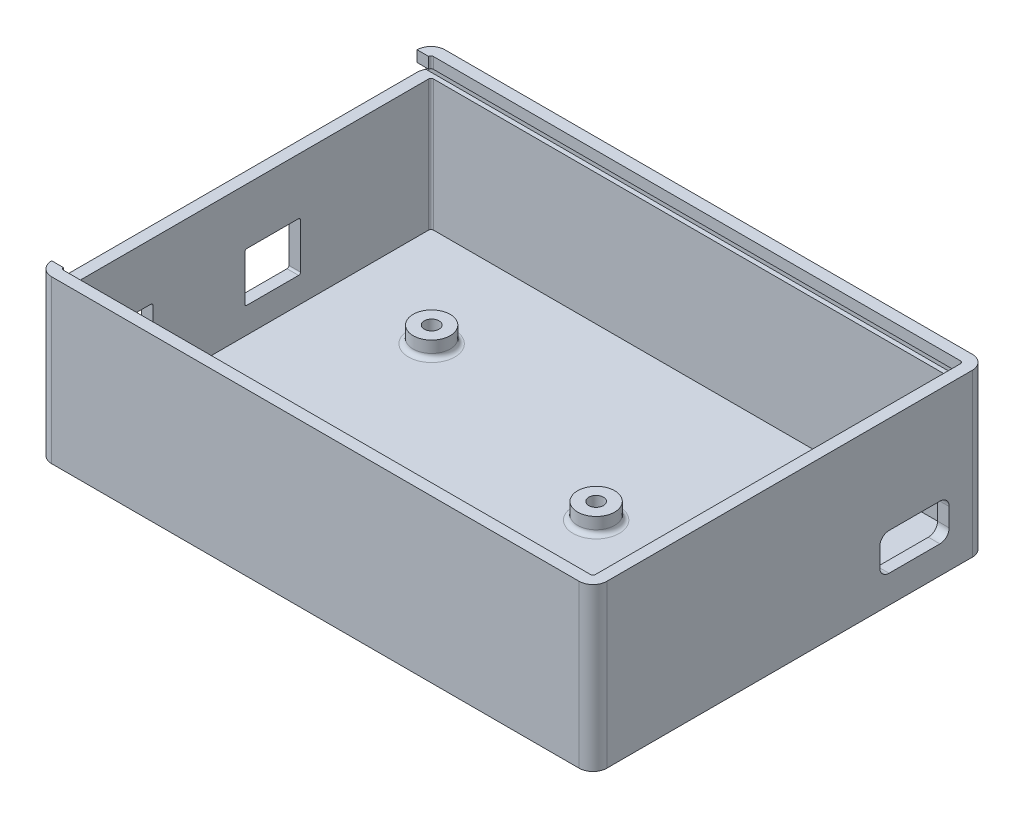
from build123d import *

# Parameters (mm, degrees)
SKETCH1_W                    = 120
SKETCH1_H                    = 85
BASE_EXTRUSION_DEPTH         = 35
EXTERNAL_CORNER_FILLETS_R    = 3
ENCLOSURE_SHELL_T            = -2.5
SKETCH2_R                    = 4
SKETCH2_R_2                  = 1.5875
ARDUINO_MOUNTING_HOLES_DEPTH = 6
STANDOFF_FILLETS_R           = 1
PORT_ACCESS_HOLE_DEPTH       = 6
SKETCH5_W                    = 15
SKETCH5_H                    = 8
WIRE_ACCESS_HOLE_DEPTH       = 6
WIRE_ACCESS_HOLE_FILLET_R    = 2
SKETCH6_R                    = 2.5
CABLE_ROUTING_POSTS_DEPTH    = 6
LID_CUT_EXTRUDE_DEPTH        = 117.5


with BuildPart() as part:
    # Sketch1 → base extrusion (new body)
    with BuildSketch(Plane(origin=(0, 0, 0), x_dir=(1, 0, 0), z_dir=(0, 1, 0))):
        Rectangle(SKETCH1_W, SKETCH1_H)
    extrude(amount=BASE_EXTRUSION_DEPTH)

    # external corner fillets
    external_corner_fillets_edges = [part.edges().sort_by_distance(p)[0] for p in [
        (60, 17.5, 42.5),
        (60, 17.5, -42.5),
        (-60, 17.5, -42.5),
        (-60, 17.5, 42.5),
    ]]
    fillet(external_corner_fillets_edges, radius=EXTERNAL_CORNER_FILLETS_R)

    # enclosure shell
    enclosure_shell_openings = [part.faces().sort_by_distance(p)[0] for p in [
        (0, 35, 0),
    ]]
    offset(amount=ENCLOSURE_SHELL_T, openings=enclosure_shell_openings, kind=Kind.INTERSECTION)

    # Sketch2 → arduino mounting holes (add)
    # profile 1 of 4: a face of its own
    with BuildSketch(Plane.XZ):
        with Locations(Location((-37.18, 29.719377118, 0), (0, 0, 270))):
            Circle(SKETCH2_R)
        with Locations(Location((-37.18, 29.719377118, 0), (0, 0, 270))):
            Circle(SKETCH2_R_2, mode=Mode.SUBTRACT)
    # profile 2 of 4: a face of its own
    with BuildSketch(Plane.XZ):
        with Locations(Location((14.89, 24.639377118, 0), (0, 0, 270))):
            Circle(SKETCH2_R)
        with Locations(Location((14.89, 24.639377118, 0), (0, 0, 270))):
            Circle(SKETCH2_R_2, mode=Mode.SUBTRACT)
    # profile 3 of 4: a face of its own
    with BuildSketch(Plane.XZ):
        with Locations(Location((14.89, -3.300622882, 0), (0, 0, 270))):
            Circle(SKETCH2_R)
        with Locations(Location((14.89, -3.300622882, 0), (0, 0, 270))):
            Circle(SKETCH2_R_2, mode=Mode.SUBTRACT)
    # profile 4 of 4: a face of its own
    with BuildSketch(Plane.XZ):
        with Locations(Location((-35.91, -18.540622882, 0), (0, 0, 270))):
            Circle(SKETCH2_R)
        with Locations(Location((-35.91, -18.540622882, 0), (0, 0, 270))):
            Circle(SKETCH2_R_2, mode=Mode.SUBTRACT)
    extrude(amount=-ARDUINO_MOUNTING_HOLES_DEPTH)

    # standoff fillets
    standoff_fillets_edges = [part.edges().sort_by_distance(p)[0] for p in [
        (-35.91, 2.5, -14.540622882),
        (14.89, 2.5, 0.699377118),
        (14.89, 2.5, 28.639377118),
        (-37.18, 2.5, 33.719377118),
    ]]
    fillet(standoff_fillets_edges, radius=STANDOFF_FILLETS_R)

    # Sketch4 → port access hole (cut)
    with BuildSketch(Plane.ZY.offset(60)):
        with BuildLine():
            Line((20.584377118, 18.65), (28.584377118, 18.65))
            ThreePointArc((28.584377118, 18.65), (28.937930508, 18.503553391), (29.084377118, 18.15))
            Line((29.084377118, 18.15), (29.084377118, 7.65))
            Line((29.084377118, 7.65), (20.084377118, 7.65))
            Line((20.084377118, 7.65), (20.084377118, 18.15))
            ThreePointArc((20.084377118, 18.15), (20.230823727, 18.503553391), (20.584377118, 18.65))
        make_face()
        with BuildLine():
            Line((-11.320622882, 18.7), (-0.200622882, 18.7))
            ThreePointArc((-0.200622882, 18.7), (0.124646237, 18.565269119), (0.259377118, 18.24))
            Line((0.259377118, 18.24), (0.259377118, 8.44))
            ThreePointArc((0.259377118, 8.44), (0.122186575, 8.182772563), (-0.150622882, 8.08))
            Line((-0.150622882, 8.08), (-11.370622882, 8.08))
            ThreePointArc((-11.370622882, 8.08), (-11.660536663, 8.20008622), (-11.780622882, 8.49))
            Line((-11.780622882, 8.49), (-11.780622882, 18.24))
            ThreePointArc((-11.780622882, 18.24), (-11.645892002, 18.565269119), (-11.320622882, 18.7))
        make_face()
    extrude(amount=-PORT_ACCESS_HOLE_DEPTH, mode=Mode.SUBTRACT)

    # Sketch5 → wire access hole (cut)
    with BuildSketch(Plane(origin=(60, 0, 0), x_dir=(0, 0, -1), z_dir=(1, 0, 0))):
        with Locations((27, 10)):
            Rectangle(SKETCH5_W, SKETCH5_H)
    extrude(amount=-WIRE_ACCESS_HOLE_DEPTH, mode=Mode.SUBTRACT)

    # wire access hole fillet
    wire_access_hole_fillet_edges = [part.edges().sort_by_distance(p)[0] for p in [
        (58.75, 14, -34.5),
        (58.75, 6, -34.5),
        (58.75, 6, -19.5),
        (58.75, 14, -19.5),
    ]]
    fillet(wire_access_hole_fillet_edges, radius=WIRE_ACCESS_HOLE_FILLET_R)

    # Sketch6 → cable routing posts (add)
    with BuildSketch(Plane(origin=(0, 2.5, 0), x_dir=(1, 0, 0), z_dir=(0, 1, 0))):
        with Locations(Location((40.747327805, 27, 0), (0, 0, 90))):
            Circle(SKETCH6_R)
        with Locations(Location((40.747327805, 15.750588276, 0), (0, 0, 90))):
            Circle(SKETCH6_R)
    extrude(amount=CABLE_ROUTING_POSTS_DEPTH)

    # Sketch10 → lid cut extrude (cut)
    with BuildSketch(Plane.ZY.offset(60)):
        Polygon((-39.5, 35), (-39.5, 32.6), (-41, 32.6), (-41, 30.8), (41, 30.8), (41, 32.6), (39.5, 32.6), (39.5, 35), align=None)
    extrude(amount=-LID_CUT_EXTRUDE_DEPTH, mode=Mode.SUBTRACT)


solid = part.part
